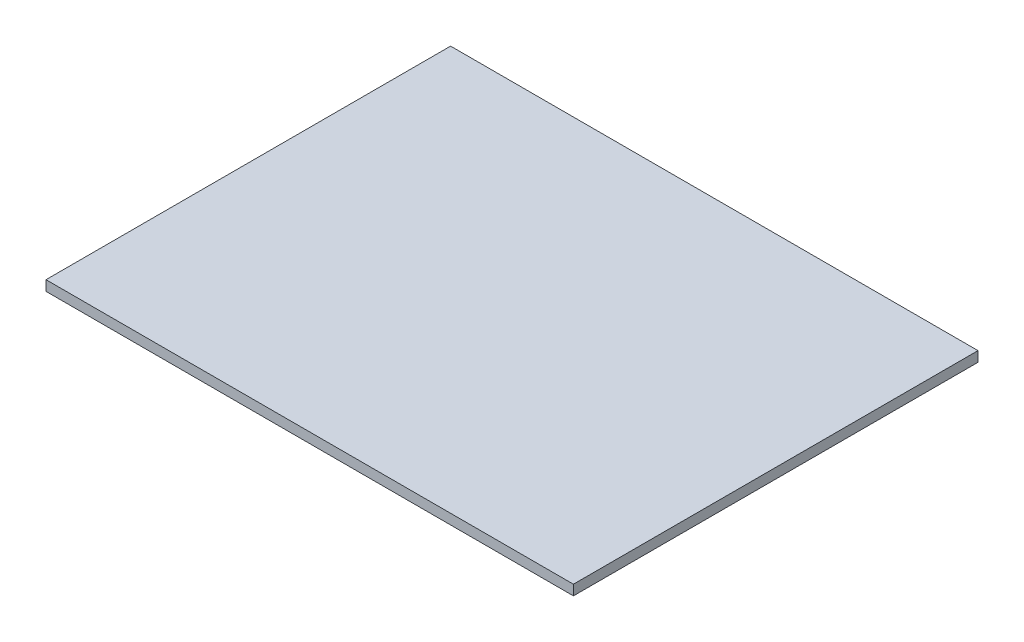
from build123d import *

# Parameters (mm, degrees)
SKETCH_1_W      = 936
SKETCH_1_H      = 718
EXTRUDE_1_DEPTH = 18


with BuildPart() as part:
    # 草图1 → 凸台-拉伸1 (new body)
    with BuildSketch(Plane(origin=(0, 0, 0), x_dir=(1, 0, 0), z_dir=(0, 1, 0))):
        with Locations((-331.128065395, 135.779291553)):
            Rectangle(SKETCH_1_W, SKETCH_1_H)
    extrude(amount=EXTRUDE_1_DEPTH)


solid = part.part
